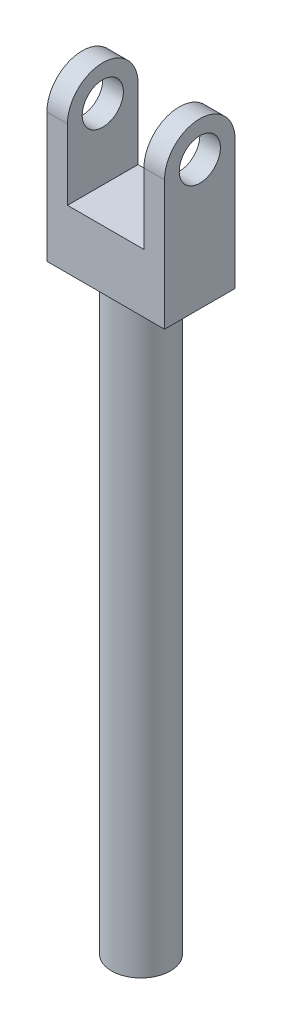
from build123d import *

# Parameters (mm, degrees)
ESBO_O1_R                = 3.5
RESSALTO_EXTRUS_O1_DEPTH = 10
ESBO_O3_W                = 13
ESBO_O3_H                = 18
CORTE_EXTRUS_O2_DEPTH    = 10
ESBO_O4_R                = 5
RESSALTO_EXTRUS_O2_DEPTH = 100


with BuildPart() as part:
    # Esboço1 → Ressalto-extrusão1 (new, symmetric)
    with BuildSketch(Plane(origin=(0, 0, 0), x_dir=(0, 0, -1), z_dir=(1, 0, 0))):
        with BuildLine():
            Line((-6, 0), (-6, -22))
            Line((-6, -22), (6, -22))
            Line((6, -22), (6, 0))
            ThreePointArc((6, 0), (0, 6), (-6, 0))
        make_face()
        Circle(ESBO_O1_R, mode=Mode.SUBTRACT)
    extrude(amount=RESSALTO_EXTRUS_O1_DEPTH, both=True)

    # Esboço3 → Corte-extrusão2 (cut, symmetric)
    with BuildSketch(Plane.XY):
        with Locations((0, -3)):
            Rectangle(ESBO_O3_W, ESBO_O3_H)
    extrude(amount=CORTE_EXTRUS_O2_DEPTH, both=True, mode=Mode.SUBTRACT)

    # Esboço4 → Ressalto-extrusão2 (add)
    with BuildSketch(Plane.XZ.offset(22)):
        with Locations(Location((0, 0, 0), (0, 0, 90))):
            Circle(ESBO_O4_R)
    extrude(amount=RESSALTO_EXTRUS_O2_DEPTH)


solid = part.part
